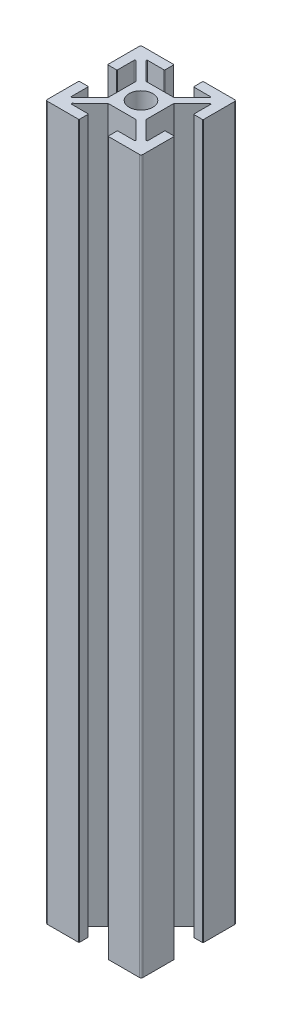
from build123d import *

# Parameters (mm, degrees)
SKETCH1_R           = 2.5
BOSS_EXTRUDE2_DEPTH = 150


with BuildPart() as part:
    # Sketch1 → Boss-Extrude2 (new body)
    with BuildSketch(Plane(origin=(0, 0, 0), x_dir=(1, 0, 0), z_dir=(0, 1, 0))):
        with BuildLine():
            Line((-9.896296296, 3), (-8.196296296, 3))
            ThreePointArc((-8.196296296, 3), (-8.090230279, 3.043933983), (-8.046296296, 3.15))
            Line((-8.046296296, 3.15), (-8.046296296, 6.586184513))
            ThreePointArc((-8.046296296, 6.586184513), (-7.954097251, 6.724600732), (-7.790842301, 6.692859041))
            Line((-7.790842301, 6.692859041), (-4, 2.945390222))
            Line((-4, 2.945390222), (-4, -2.945390222))
            Line((-4, -2.945390222), (-7.790842301, -6.692859041))
            ThreePointArc((-7.790842301, -6.692859041), (-7.954097251, -6.724600732), (-8.046296296, -6.586184513))
            Line((-8.046296296, -6.586184513), (-8.046296296, -3.15))
            ThreePointArc((-8.046296296, -3.15), (-8.090230279, -3.043933983), (-8.196296296, -3))
            Line((-8.196296296, -3), (-9.896296296, -3))
            ThreePointArc((-9.896296296, -3), (-10.002362313, -3.043933983), (-10.046296296, -3.15))
            Line((-10.046296296, -3.15), (-10.046296296, -9.65))
            ThreePointArc((-10.046296296, -9.65), (-9.94378367, -9.897487373), (-9.696296296, -10))
            Line((-9.696296296, -10), (-3.196296296, -10))
            ThreePointArc((-3.196296296, -10), (-3.090230279, -9.956066017), (-3.046296296, -9.85))
            Line((-3.046296296, -9.85), (-3.046296296, -8.15))
            ThreePointArc((-3.046296296, -8.15), (-3.090230279, -8.043933983), (-3.196296296, -8))
            Line((-3.196296296, -8), (-6.614381093, -8))
            ThreePointArc((-6.614381093, -8), (-6.753127587, -7.9070036), (-6.719835089, -7.743325472))
            Line((-6.719835089, -7.743325472), (-2.93318409, -4))
            Line((-2.93318409, -4), (2.93318409, -4))
            Line((2.93318409, -4), (6.719835089, -7.743325472))
            ThreePointArc((6.719835089, -7.743325472), (6.753127587, -7.9070036), (6.614381093, -8))
            Line((6.614381093, -8), (3.196296296, -8))
            ThreePointArc((3.196296296, -8), (3.090230279, -8.043933983), (3.046296296, -8.15))
            Line((3.046296296, -8.15), (3.046296296, -9.85))
            ThreePointArc((3.046296296, -9.85), (3.090230279, -9.956066017), (3.196296296, -10))
            Line((3.196296296, -10), (9.696296296, -10))
            ThreePointArc((9.696296296, -10), (9.94378367, -9.897487373), (10.046296296, -9.65))
            Line((10.046296296, -9.65), (10.046296296, -3.15))
            ThreePointArc((10.046296296, -3.15), (10.002362313, -3.043933983), (9.896296296, -3))
            Line((9.896296296, -3), (8.196296296, -3))
            ThreePointArc((8.196296296, -3), (8.090230279, -3.043933983), (8.046296296, -3.15))
            Line((8.046296296, -3.15), (8.046296296, -6.586184513))
            ThreePointArc((8.046296296, -6.586184513), (7.954097251, -6.724600732), (7.790842301, -6.692859041))
            Line((7.790842301, -6.692859041), (4, -2.945390222))
            Line((4, -2.945390222), (4, 2.945390222))
            Line((4, 2.945390222), (7.790842301, 6.692859041))
            ThreePointArc((7.790842301, 6.692859041), (7.954097251, 6.724600732), (8.046296296, 6.586184513))
            Line((8.046296296, 6.586184513), (8.046296296, 3.15))
            ThreePointArc((8.046296296, 3.15), (8.090230279, 3.043933983), (8.196296296, 3))
            Line((8.196296296, 3), (9.896296296, 3))
            ThreePointArc((9.896296296, 3), (10.002362313, 3.043933983), (10.046296296, 3.15))
            Line((10.046296296, 3.15), (10.046296296, 9.65))
            ThreePointArc((10.046296296, 9.65), (9.94378367, 9.897487373), (9.696296296, 10))
            Line((9.696296296, 10), (3.196296296, 10))
            ThreePointArc((3.196296296, 10), (3.090230279, 9.956066017), (3.046296296, 9.85))
            Line((3.046296296, 9.85), (3.046296296, 8.15))
            ThreePointArc((3.046296296, 8.15), (3.090230279, 8.043933983), (3.196296296, 8))
            Line((3.196296296, 8), (6.614381093, 8))
            ThreePointArc((6.614381093, 8), (6.753127587, 7.9070036), (6.719835089, 7.743325472))
            Line((6.719835089, 7.743325472), (2.93318409, 4))
            Line((2.93318409, 4), (-2.93318409, 4))
            Line((-2.93318409, 4), (-6.719835089, 7.743325472))
            ThreePointArc((-6.719835089, 7.743325472), (-6.753127587, 7.9070036), (-6.614381093, 8))
            Line((-6.614381093, 8), (-3.196296296, 8))
            ThreePointArc((-3.196296296, 8), (-3.090230279, 8.043933983), (-3.046296296, 8.15))
            Line((-3.046296296, 8.15), (-3.046296296, 9.85))
            ThreePointArc((-3.046296296, 9.85), (-3.090230279, 9.956066017), (-3.196296296, 10))
            Line((-3.196296296, 10), (-9.696296296, 10))
            ThreePointArc((-9.696296296, 10), (-9.94378367, 9.897487373), (-10.046296296, 9.65))
            Line((-10.046296296, 9.65), (-10.046296296, 3.15))
            ThreePointArc((-10.046296296, 3.15), (-10.002362313, 3.043933983), (-9.896296296, 3))
        make_face()
        with Locations(Location((0, 0, 0), (0, 0, 270))):
            Circle(SKETCH1_R, mode=Mode.SUBTRACT)
    extrude(amount=BOSS_EXTRUDE2_DEPTH)


solid = part.part
